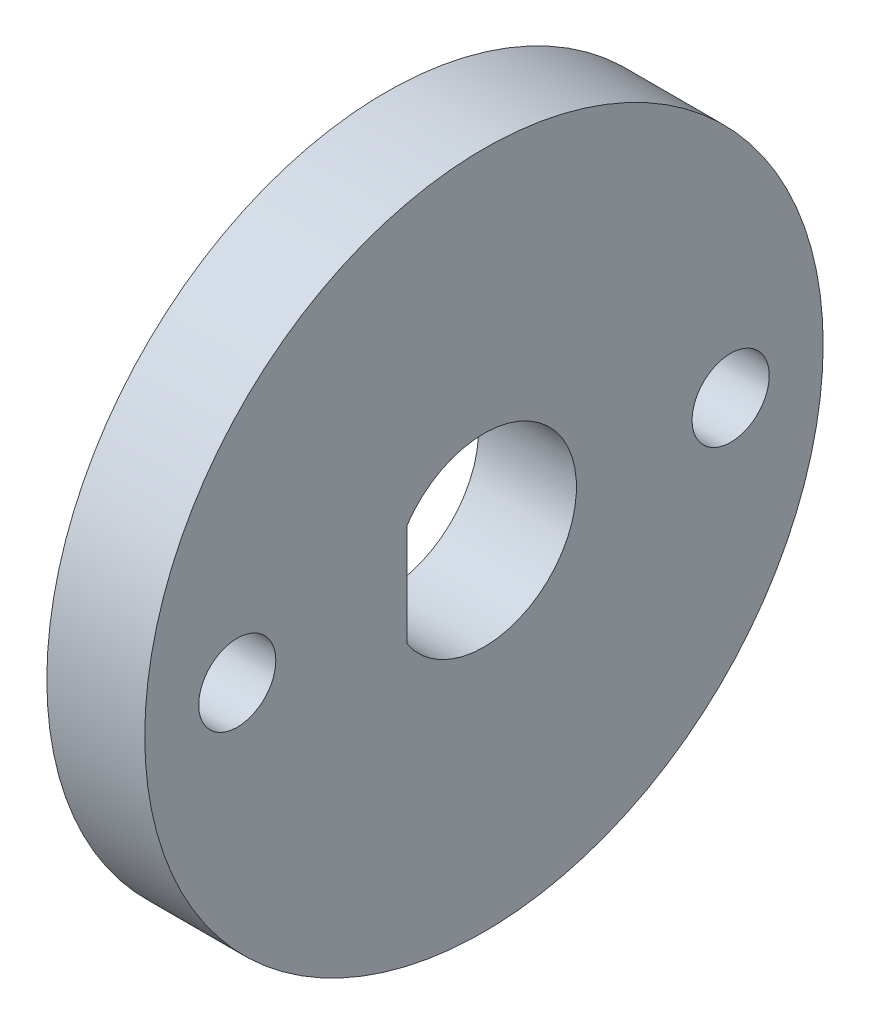
from build123d import *

# Parameters (mm, degrees)
SKETCH1_R           = 11
SKETCH1_R_2         = 1.25
BOSS_EXTRUDE1_DEPTH = 3.175


with BuildPart() as part:
    # Sketch1 → Boss-Extrude1 (new body)
    with BuildSketch(Plane(origin=(0, 0, 0), x_dir=(0, 0, -1), z_dir=(1, 0, 0))):
        Circle(SKETCH1_R)
        with BuildLine():
            ThreePointArc((-2.5, 1.658312395), (0.866025404, 2.872281323), (3, 0))
            ThreePointArc((3, 0), (0.866025404, -2.872281323), (-2.5, -1.658312395))
            Line((-2.5, -1.658312395), (-2.5, 1.658312395))
        make_face(mode=Mode.SUBTRACT)
        with Locations((-8, 0)):
            Circle(SKETCH1_R_2, mode=Mode.SUBTRACT)
        with Locations((8, 0)):
            Circle(SKETCH1_R_2, mode=Mode.SUBTRACT)
    extrude(amount=BOSS_EXTRUDE1_DEPTH)


solid = part.part
